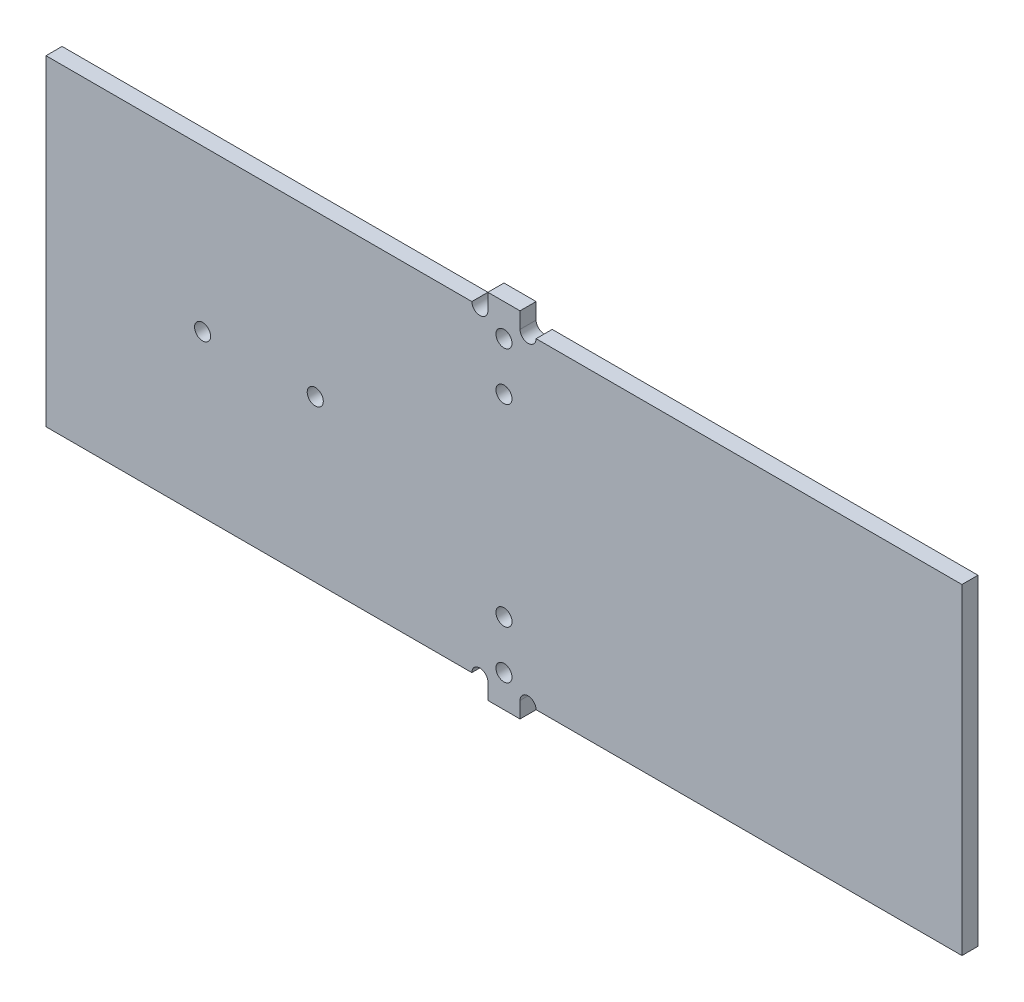
from build123d import *

# Parameters (mm, degrees)
SKETCH_1_R          = 1
EXTRUDE_1_DEPTH     = 2
SKETCH_2_R          = 1
CUT_EXTRUDE_1_DEPTH = 2


with BuildPart() as part:
    # 草圖1 → 填料-伸長1 (new body)
    with BuildSketch(Plane.XY):
        with BuildLine():
            Line((5.339530581, 31.894382022), (57.339530581, 31.894382022))
            Line((57.339530581, 31.894382022), (58.339530581, 31.894382022))
            Line((58.339530581, 31.894382022), (58.339530581, 30.894382022))
            Line((58.339530581, 30.894382022), (58.339530581, -7.105617978))
            Line((58.339530581, -7.105617978), (58.339530581, -8.105617978))
            Line((58.339530581, -8.105617978), (57.339530581, -8.105617978))
            Line((57.339530581, -8.105617978), (5.339530581, -8.105617978))
            ThreePointArc((5.339530581, -8.105617978), (4.339530581, -7.105617978), (3.339530581, -8.105617978))
            Line((3.339530581, -8.105617978), (3.339530581, -10.105617978))
            Line((3.339530581, -10.105617978), (-0.660469419, -10.105617978))
            Line((-0.660469419, -10.105617978), (-0.660469419, -8.105617978))
            ThreePointArc((-0.660469419, -8.105617978), (-1.660469419, -7.105617978), (-2.660469419, -8.105617978))
            Line((-2.660469419, -8.105617978), (-54.660469419, -8.105617978))
            Line((-54.660469419, -8.105617978), (-55.660469419, -8.105617978))
            Line((-55.660469419, -8.105617978), (-55.660469419, -7.105617978))
            Line((-55.660469419, -7.105617978), (-55.660469419, 30.894382022))
            Line((-55.660469419, 30.894382022), (-55.660469419, 31.894382022))
            Line((-55.660469419, 31.894382022), (-54.660469419, 31.894382022))
            Line((-54.660469419, 31.894382022), (-2.660469419, 31.894382022))
            ThreePointArc((-2.660469419, 31.894382022), (-1.660469419, 30.894382022), (-0.660469419, 31.894382022))
            Line((-0.660469419, 31.894382022), (-0.660469419, 33.894382022))
            Line((-0.660469419, 33.894382022), (3.339530581, 33.894382022))
            Line((3.339530581, 33.894382022), (3.339530581, 31.894382022))
            ThreePointArc((3.339530581, 31.894382022), (4.339530581, 30.894382022), (5.339530581, 31.894382022))
        make_face()
        with Locations((1.339530581, -6.105617978)):
            Circle(SKETCH_1_R, mode=Mode.SUBTRACT)
        with Locations((1.339530581, 29.894382022)):
            Circle(SKETCH_1_R, mode=Mode.SUBTRACT)
    extrude(amount=EXTRUDE_1_DEPTH)

    # 草圖2 → 除料-伸長1 (cut)
    with BuildSketch(Plane.XY.offset(2)):
        with Locations((1.339530581, 23.894382022)):
            Circle(SKETCH_2_R)
        with Locations((1.339530581, -0.105617978)):
            Circle(SKETCH_2_R)
        with Locations((-36.172114849, 11.894382022)):
            Circle(SKETCH_2_R)
        with Locations((-22.148823989, 11.894382022)):
            Circle(SKETCH_2_R)
    extrude(amount=-CUT_EXTRUDE_1_DEPTH, mode=Mode.SUBTRACT)


solid = part.part
